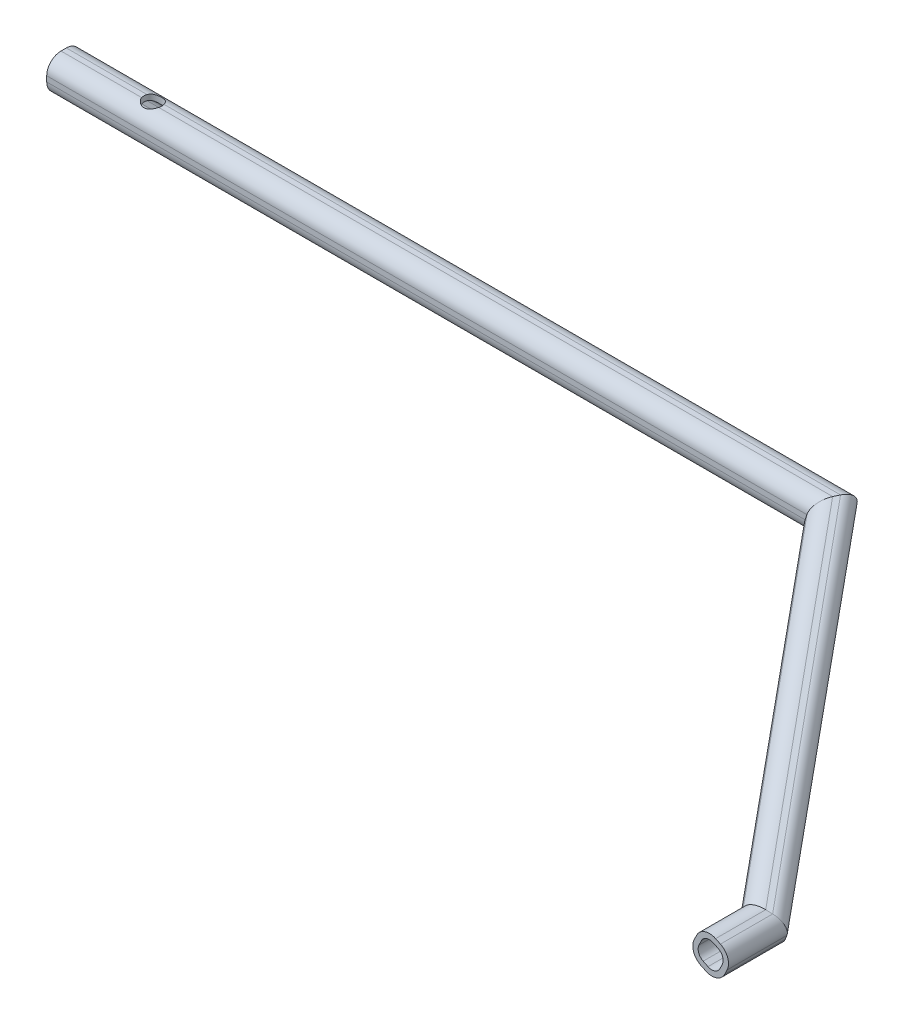
from build123d import *

# Parameters (mm, degrees)
CUT_EXTRUDE3_DEPTH      = 563.167093213
CUT_EXTRUDE3_DEPTH_BACK = 563.167093213
SKETCH21_R              = 5


with BuildPart() as part:
    # Sweep-Thin3: sweep along a curve in space
    with BuildLine() as sweep_thin3_path:
        Line((0, 0, 0), (430, 0, 0))
        Line((430, 0, 0), (520.097414894, -91.087777242, 127.5))
        Line((520.097414894, -91.087777242, 127.5), (520.097414894, -91.087777242, 157.5))
    # Sketch2 → Sweep-Thin3 (sweep)
    with BuildSketch(Plane(origin=(0, 0, 0), x_dir=(0, 0, -1), z_dir=(1, 0, 0))):
        with BuildLine():
            Line((1.5, 9.5), (-1.5, 9.5))
            ThreePointArc((-1.5, 9.5), (-7.156854249, 7.156854249), (-9.5, 1.5))
            Line((-9.5, 1.5), (-9.5, -1.5))
            ThreePointArc((-9.5, -1.5), (-7.156854249, -7.156854249), (-1.5, -9.5))
            Line((-1.5, -9.5), (1.5, -9.5))
            ThreePointArc((1.5, -9.5), (7.156854249, -7.156854249), (9.5, -1.5))
            Line((9.5, -1.5), (9.5, 1.5))
            ThreePointArc((9.5, 1.5), (7.156854249, 7.156854249), (1.5, 9.5))
        make_face()
        with BuildLine():
            Line((1.5, 6.5), (-1.5, 6.5))
            ThreePointArc((-1.5, 6.5), (-5.035533906, 5.035533906), (-6.5, 1.5))
            Line((-6.5, 1.5), (-6.5, -1.5))
            ThreePointArc((-6.5, -1.5), (-5.035533906, -5.035533906), (-1.5, -6.5))
            Line((-1.5, -6.5), (1.5, -6.5))
            ThreePointArc((1.5, -6.5), (5.035533906, -5.035533906), (6.5, -1.5))
            Line((6.5, -1.5), (6.5, 1.5))
            ThreePointArc((6.5, 1.5), (5.035533906, 5.035533906), (1.5, 6.5))
        make_face(mode=Mode.SUBTRACT)
    sweep(path=sweep_thin3_path.line, transition=Transition.RIGHT)

    # Sketch21 → Cut-Extrude3 (cut, two sides: drawn at the far end of the back side and taken through both)
    with BuildSketch(Plane(origin=(0, 0, 0), x_dir=(1, 0, 0), z_dir=(0, 1, 0)).offset(-CUT_EXTRUDE3_DEPTH_BACK)):
        with Locations(Location((50, 0, 0), (0, 0, 342.542396876))):
            Circle(SKETCH21_R)
    extrude(amount=CUT_EXTRUDE3_DEPTH + CUT_EXTRUDE3_DEPTH_BACK, mode=Mode.SUBTRACT)


solid = part.part
